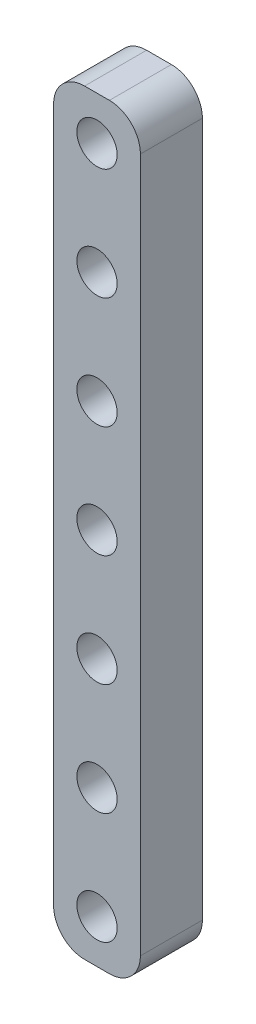
from build123d import *

# Parameters (mm, degrees)
SKETCH1_W                = 12
SKETCH1_H                = 109.262
BOSS_EXTRUDE1_DEPTH      = 4
FILLET1_R                = 5
CUT_EXTRUDE1_DEPTH       = 10.5
SKETCH4_W                = 12
SKETCH4_H                = 6.738165359
BOSS_EXTRUDE2_DEPTH      = 4
BOSS_EXTRUDE3_DEPTH      = 6
BOSS_EXTRUDE3_DEPTH_BACK = 4
SKETCH5_W                = 14
SKETCH5_H                = 122.000165359
SKETCH6_R                = 3.25
CUT_EXTRUDE3_DEPTH       = 10
FILLET2_R                = 5
LPATTERN1_COUNT          = 7
LPATTERN1_PITCH          = 18


with BuildPart() as part:
    # Sketch1 → Boss-Extrude1 (new body)
    with BuildSketch(Plane.XY):
        with Locations((0, 50)):
            Rectangle(SKETCH1_W, SKETCH1_H)
    extrude(amount=BOSS_EXTRUDE1_DEPTH)

    # Fillet1
    fillet1_edges = [part.edges().sort_by_distance(p)[0] for p in [
        (-6, -4.631, 2),
        (6, -4.631, 2),
    ]]
    fillet(fillet1_edges, radius=FILLET1_R)

    # Sketch2 → Cut-Extrude1 (cut)
    with BuildSketch(Plane.XY.offset(4)):
        with BuildLine():
            Line((2, 98.631), (2, 1.369))
            ThreePointArc((2, 1.369), (0, -0.631), (-2, 1.369))
            Line((-2, 1.369), (-2, 98.631))
            ThreePointArc((-2, 98.631), (0, 100.631), (2, 98.631))
        make_face()
    extrude(amount=-CUT_EXTRUDE1_DEPTH, mode=Mode.SUBTRACT)

    # Sketch4 → Boss-Extrude2 (add)
    with BuildSketch(Plane.XY.offset(4)):
        with Locations((0, 108.000082679)):
            Rectangle(SKETCH4_W, SKETCH4_H)
    extrude(amount=-BOSS_EXTRUDE2_DEPTH)

    # Sketch5 → Boss-Extrude3 (add, two sides: drawn at the far end of the back side and taken through both)
    with BuildSketch(Plane(origin=(0, 0, 0), x_dir=(-1, 0, 0), z_dir=(0, 0, -1)).offset(-BOSS_EXTRUDE3_DEPTH_BACK)):
        with Locations((0, 56.36908268)):
            Rectangle(SKETCH5_W, SKETCH5_H)
    extrude(amount=BOSS_EXTRUDE3_DEPTH + BOSS_EXTRUDE3_DEPTH_BACK)

    # Sketch6 → Cut-Extrude3 (cut)
    with BuildSketch(Plane(origin=(0, 0, -6), x_dir=(-1, 0, 0), z_dir=(0, 0, -1))):
        with Locations((0, 110.369165359)):
            Circle(SKETCH6_R)
    cut_extrude3 = extrude(amount=-CUT_EXTRUDE3_DEPTH, mode=Mode.SUBTRACT)

    # Fillet2
    fillet2_edges = [part.edges().sort_by_distance(p)[0] for p in [
        (-7, -4.631, -1),
        (-7, 117.369165359, -1),
        (7, 117.369165359, -1),
        (7, -4.631, -1),
    ]]
    fillet(fillet2_edges, radius=FILLET2_R)

    # LPattern1: Cut-Extrude3 ×7
    with Locations(*[(0, -i * LPATTERN1_PITCH, 0) for i in range(1, LPATTERN1_COUNT)]):
        add(cut_extrude3, mode=Mode.SUBTRACT)


solid = part.part
